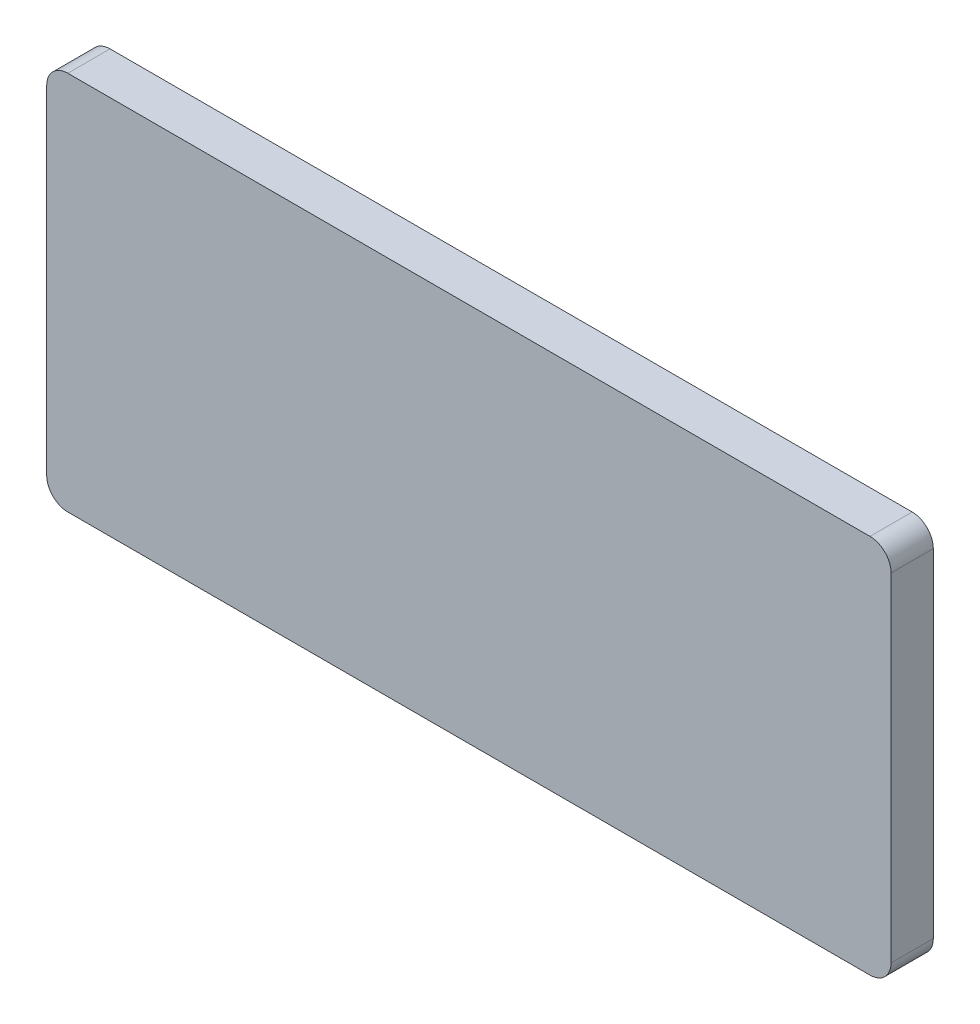
from build123d import *

# Parameters (mm, degrees)
SKETCH1_W           = 508
SKETCH1_H           = 228.6
BOSS_EXTRUDE1_DEPTH = 25.4
FILLET3_R           = 12.7
FILLET4_R           = 12.7


with BuildPart() as part:
    # Sketch1 → Boss-Extrude1 (new body)
    with BuildSketch(Plane.XY):
        Rectangle(SKETCH1_W, SKETCH1_H)
    extrude(amount=BOSS_EXTRUDE1_DEPTH)

    # Fillet3
    fillet3_edges = [part.edges().sort_by_distance(p)[0] for p in [
        (254, 114.3, 12.7),
    ]]
    fillet(fillet3_edges, radius=FILLET3_R)

    # Fillet4
    fillet4_edges = [part.edges().sort_by_distance(p)[0] for p in [
        (-254, -114.3, 12.7),
        (254, -114.3, 12.7),
        (-254, 114.3, 12.7),
    ]]
    fillet(fillet4_edges, radius=FILLET4_R)


solid = part.part
